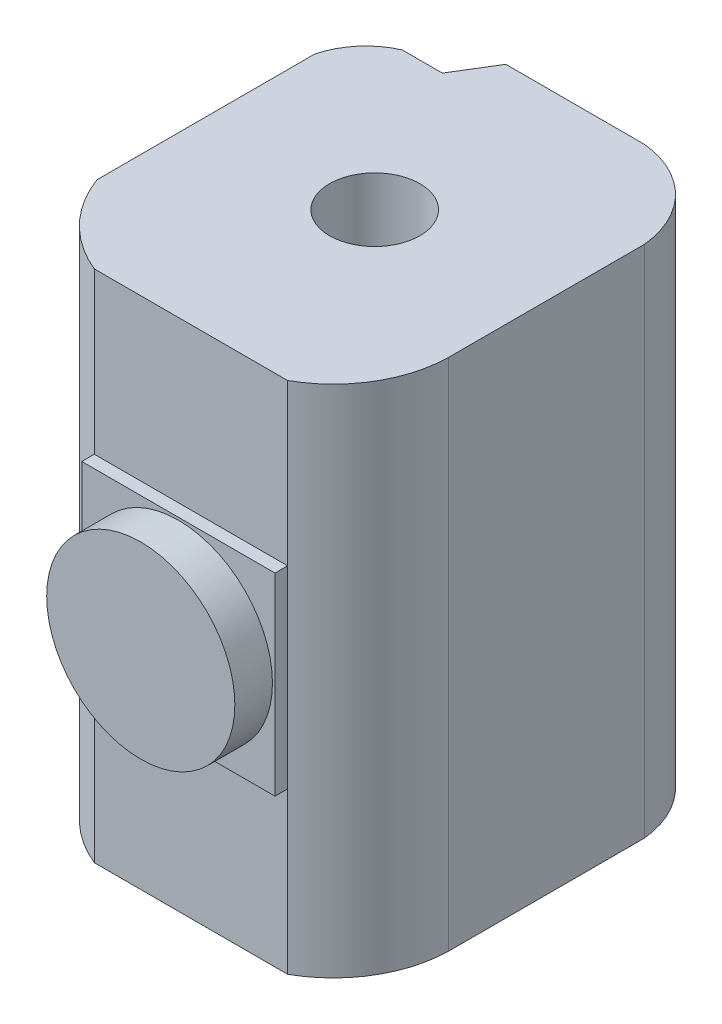
from build123d import *

# Parameters (mm, degrees)
SKETCH3_W               = 262.8
SKETCH3_H               = 305.28
BOSS_EXTRUDE3_DEPTH     = 410
CUT_EXTRUDE1_DEPTH      = 457.798565672
CUT_EXTRUDE1_DEPTH_BACK = 457.798565672
CUT_EXTRUDE2_DEPTH      = 457.798565672
CUT_EXTRUDE2_DEPTH_BACK = 457.798565672
SKETCH5_R               = 36
SKETCH6_W               = 154.08
SKETCH6_H               = 154.08
BOSS_EXTRUDE4_DEPTH     = 10
SKETCH7_R               = 75
BOSS_EXTRUDE5_DEPTH     = 30


with BuildPart() as part:
    # Sketch3 → Boss-Extrude3 (new body)
    with BuildSketch(Plane(origin=(0, 0, 0), x_dir=(1, 0, 0), z_dir=(0, 1, 0))):
        Rectangle(SKETCH3_W, SKETCH3_H)
    extrude(amount=BOSS_EXTRUDE3_DEPTH)

    # Sketch4 → Cut-Extrude1 (cut, two sides: drawn at the far end of the back side and taken through both)
    with BuildSketch(Plane(origin=(0, 410, 0), x_dir=(1, 0, 0), z_dir=(0, 1, 0)).offset(-CUT_EXTRUDE1_DEPTH_BACK)):
        with BuildLine():
            Line((-131.4, -90), (-131.4, -152.64))
            Line((-131.4, -152.64), (-70.92, -152.64))
            ThreePointArc((-70.92, -152.64), (-107.755247271, -127.687824951), (-131.4, -90))
        make_face()
        with BuildLine():
            Line((83.16, -152.64), (131.4, -152.64))
            Line((131.4, -152.64), (131.4, -72.72))
            ThreePointArc((131.4, -72.72), (117.938305095, -119.113391364), (83.16, -152.64))
        make_face()
        with BuildLine():
            Line((-99.372734155, 121.287125755), (-67.345468311, 121.287125755))
            Line((-67.345468311, 121.287125755), (-48.15934209, 152.64))
            Line((-48.15934209, 152.64), (-131.4, 152.64))
            Line((-131.4, 152.64), (-131.4, 83.52))
            ThreePointArc((-131.4, 83.52), (-119.737831056, 106.093689962), (-99.372734155, 121.287125755))
        make_face()
        with BuildLine():
            Line((131.4, 83.52), (131.4, 152.64))
            Line((131.4, 152.64), (62.28, 152.64))
            ThreePointArc((62.28, 152.64), (109.286007047, 130.526007047), (131.4, 83.52))
        make_face()
    extrude(amount=CUT_EXTRUDE1_DEPTH + CUT_EXTRUDE1_DEPTH_BACK, mode=Mode.SUBTRACT)

    # Sketch5 → Cut-Extrude2 (cut, two sides: drawn at the far end of the back side and taken through both)
    with BuildSketch(Plane(origin=(0, 410, 0), x_dir=(1, 0, 0), z_dir=(0, 1, 0)).offset(-CUT_EXTRUDE2_DEPTH_BACK)):
        with Locations(Location((0, 0, 0), (0, 0, 270))):
            Circle(SKETCH5_R)
    extrude(amount=CUT_EXTRUDE2_DEPTH + CUT_EXTRUDE2_DEPTH_BACK, mode=Mode.SUBTRACT)

    # Sketch6 → Boss-Extrude4 (add)
    with BuildSketch(Plane.XY.offset(152.64)):
        with Locations((6.12, 205)):
            Rectangle(SKETCH6_W, SKETCH6_H)
    extrude(amount=BOSS_EXTRUDE4_DEPTH)

    # Sketch7 → Boss-Extrude5 (add)
    with BuildSketch(Plane.XY.offset(162.64)):
        with Locations((6.12, 205)):
            Circle(SKETCH7_R)
    extrude(amount=BOSS_EXTRUDE5_DEPTH)


solid = part.part
